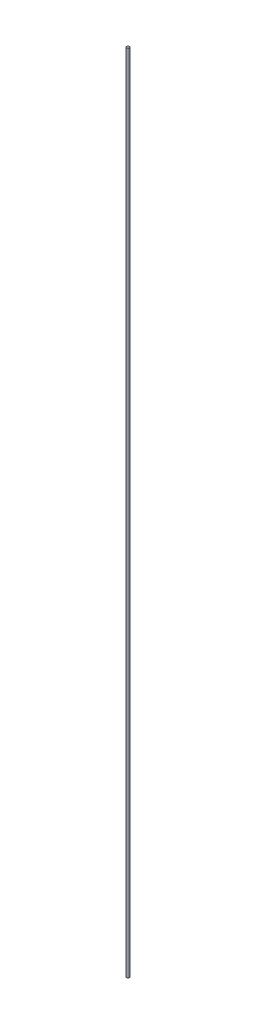
from build123d import *

# Parameters (mm, degrees)
SKETCH1_R           = 2.5
BOSS_EXTRUDE1_DEPTH = 1500


with BuildPart() as part:
    # Sketch1 → Boss-Extrude1 (new body)
    with BuildSketch(Plane(origin=(0, 0, 0), x_dir=(1, 0, 0), z_dir=(0, 1, 0))):
        with Locations(Location((0, 0, 0), (0, 0, 270))):
            Circle(SKETCH1_R)
    extrude(amount=BOSS_EXTRUDE1_DEPTH)


solid = part.part
